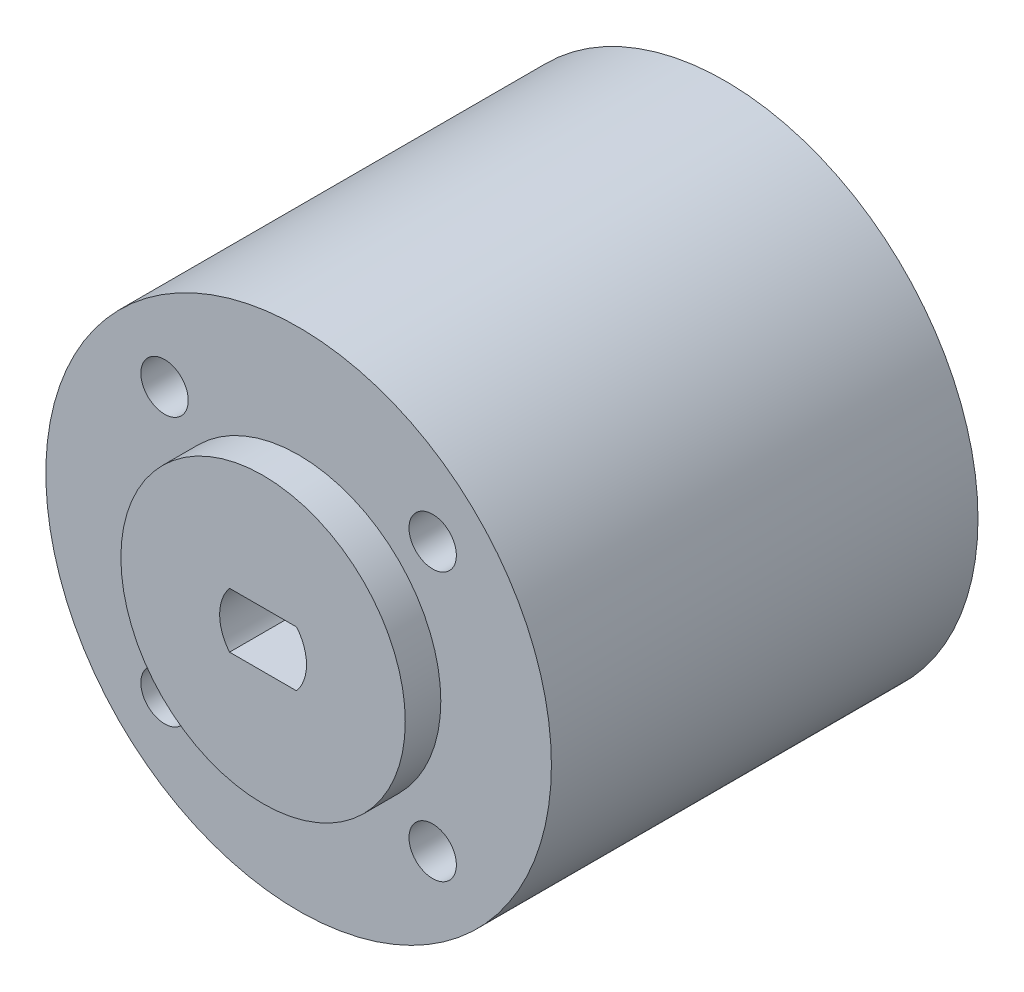
from build123d import *

# Parameters (mm, degrees)
SKETCH1_R           = 16
SKETCH1_R_2         = 9
SKETCH1_R_3         = 1.5
BOSS_EXTRUDE3_DEPTH = 13.5
SKETCH1_6_R         = 9
SKETCH1_6_R_2       = 7.5
BOSS_EXTRUDE4_DEPTH = 15.75
BOSS_EXTRUDE6_START = -31.5
SKETCH2_R           = 7.5
SKETCH2_R_2         = 2.75
BOSS_EXTRUDE6_DEPTH = 31.5


with BuildPart() as part:
    # Sketch1 → Boss-Extrude3 (new, symmetric)
    with BuildSketch(Plane.XY):
        Circle(SKETCH1_R)
        Circle(SKETCH1_R_2, mode=Mode.SUBTRACT)
        with Locations((-8.485281374, -8.485281374)):
            Circle(SKETCH1_R_3, mode=Mode.SUBTRACT)
        with Locations((8.485281374, -8.485281374)):
            Circle(SKETCH1_R_3, mode=Mode.SUBTRACT)
        with Locations((8.485281374, 8.485281374)):
            Circle(SKETCH1_R_3, mode=Mode.SUBTRACT)
        with Locations((-8.485281374, 8.485281374)):
            Circle(SKETCH1_R_3, mode=Mode.SUBTRACT)
    extrude(amount=BOSS_EXTRUDE3_DEPTH, both=True)

    # Sketch1<6> → Boss-Extrude4 (add, symmetric)
    with BuildSketch(Plane.XY):
        Circle(SKETCH1_6_R)
        Circle(SKETCH1_6_R_2, mode=Mode.SUBTRACT)
    extrude(amount=BOSS_EXTRUDE4_DEPTH, both=True)

    # Sketch2 → Boss-Extrude6 (add)
    # profile 1 of 3: a face of its own
    with BuildSketch(Plane.XY.offset(15.75).offset(BOSS_EXTRUDE6_START)):
        Circle(SKETCH2_R)
        Circle(SKETCH2_R_2, mode=Mode.SUBTRACT)
    # profile 2 of 3: a face of its own
    with BuildSketch(Plane.XY.offset(15.75).offset(BOSS_EXTRUDE6_START)):
        with BuildLine():
            ThreePointArc((2.121320344, 1.75), (0, 2.75), (-2.121320344, 1.75))
            Line((-2.121320344, 1.75), (2.121320344, 1.75))
        make_face()
    # profile 3 of 3: a face of its own
    with BuildSketch(Plane.XY.offset(15.75).offset(BOSS_EXTRUDE6_START)):
        with BuildLine():
            Line((2.121320344, -1.75), (-2.121320344, -1.75))
            ThreePointArc((-2.121320344, -1.75), (0, -2.75), (2.121320344, -1.75))
        make_face()
    extrude(amount=BOSS_EXTRUDE6_DEPTH)


solid = part.part
